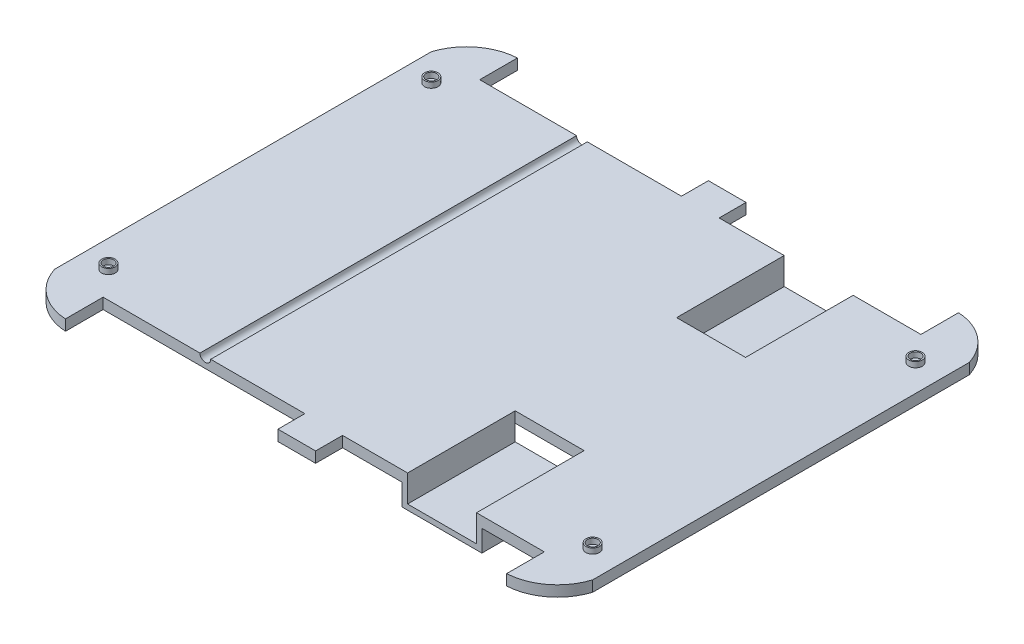
from build123d import *

# Parameters (mm, degrees)
BOSS_EXTRUDE2_DEPTH     = 2
CUT_EXTRUDE4_DEPTH      = 66.329931884
CUT_EXTRUDE4_DEPTH_BACK = 66.329931884
SKETCH4_R               = 1
BOSS_EXTRUDE3_START     = -15
BOSS_EXTRUDE3_DEPTH     = 20
BOSS_EXTRUDE4_START     = -85
BOSS_EXTRUDE4_DEPTH     = 20
CUT_EXTRUDE5_DEPTH      = 1
CUT_EXTRUDE5_DEPTH_BACK = 40
CUT_EXTRUDE5_START      = 5
SKETCH6_4_W             = 12.81
SKETCH6_4_H             = 5
CUT_EXTRUDE6_START      = -65
SKETCH6_6_W             = 12.81
SKETCH6_6_H             = 5
CUT_EXTRUDE6_DEPTH      = 20
SKETCH11_R              = 1.25
SKETCH11_R_2            = 1
BOSS_EXTRUDE6_DEPTH     = 1


with BuildPart() as part:
    # Sketch1 → Boss-Extrude2 (new body)
    with BuildSketch(Plane(origin=(0, 0, 0), x_dir=(1, 0, 0), z_dir=(0, 1, 0))):
        with BuildLine():
            Line((-3.5, 40), (-3.5, 35))
            Line((-3.5, 35), (-41, 35))
            Line((-41, 35), (-41, 42))
            ThreePointArc((-41, 42), (-46.59536929, 39.908331945), (-50, 35))
            Line((-50, 35), (-50, -35))
            ThreePointArc((-50, -35), (-46.59536929, -39.908331945), (-41, -42))
            Line((-41, -42), (-41, -35))
            Line((-41, -35), (-3.5, -35))
            Line((-3.5, -35), (-3.5, -40))
            Line((-3.5, -40), (3.5, -40))
            Line((3.5, -40), (3.5, -35))
            Line((3.5, -35), (41, -35))
            Line((41, -35), (41, -42))
            ThreePointArc((41, -42), (46.59536929, -39.908331945), (50, -35))
            Line((50, -35), (50, 35))
            ThreePointArc((50, 35), (46.59536929, 39.908331945), (41, 42))
            Line((41, 42), (41, 35))
            Line((41, 35), (3.5, 35))
            Line((3.5, 35), (3.5, 40))
            Line((3.5, 40), (-3.5, 40))
        make_face()
    extrude(amount=BOSS_EXTRUDE2_DEPTH)

    # Sketch4 → Cut-Extrude4 (cut, two sides: drawn at the far end of the back side and taken through both)
    with BuildSketch(Plane.XY.offset(-CUT_EXTRUDE4_DEPTH_BACK)):
        with Locations((-22, 2)):
            Circle(SKETCH4_R)
    extrude(amount=CUT_EXTRUDE4_DEPTH + CUT_EXTRUDE4_DEPTH_BACK, mode=Mode.SUBTRACT)

    # Sketch6 → Boss-Extrude3 (add)
    with BuildSketch(Plane.XY.offset(50).offset(BOSS_EXTRUDE3_START)):
        Polygon((15.595, -3), (15.595, 0), (14.595, 0), (14.595, -4), (29.405, -4), (29.405, 0), (28.405, 0), (28.405, -3), align=None)
    extrude(amount=-BOSS_EXTRUDE3_DEPTH)

    # Sketch6<3> → Boss-Extrude4 (add)
    with BuildSketch(Plane.XY.offset(50).offset(BOSS_EXTRUDE4_START)):
        Polygon((15.595, -3), (15.595, 0), (14.595, 0), (14.595, -4), (29.405, -4), (29.405, 0), (28.405, 0), (28.405, -3), align=None)
    extrude(amount=BOSS_EXTRUDE4_DEPTH)

    # Sketch6<4> → Cut-Extrude5 (cut, two sides: drawn at the far end of the back side and taken through both)
    with BuildSketch(Plane.XY.offset(50).offset(CUT_EXTRUDE5_START - CUT_EXTRUDE5_DEPTH_BACK)):
        with Locations((22, -0.5)):
            Rectangle(SKETCH6_4_W, SKETCH6_4_H)
    extrude(amount=CUT_EXTRUDE5_DEPTH + CUT_EXTRUDE5_DEPTH_BACK, mode=Mode.SUBTRACT)

    # Sketch6<6> → Cut-Extrude6 (cut)
    with BuildSketch(Plane.XY.offset(50).offset(CUT_EXTRUDE6_START)):
        with Locations((22, -0.5)):
            Rectangle(SKETCH6_6_W, SKETCH6_6_H)
    extrude(amount=-CUT_EXTRUDE6_DEPTH, mode=Mode.SUBTRACT)

    # Sketch11 → Boss-Extrude6 (add)
    # profile 1 of 4: a face of its own
    with BuildSketch(Plane(origin=(0, 2, 0), x_dir=(1, 0, 0), z_dir=(0, 1, 0))):
        with Locations((-45, 30)):
            Circle(SKETCH11_R)
        with Locations((-45, 30)):
            Circle(SKETCH11_R_2, mode=Mode.SUBTRACT)
    # profile 2 of 4: a face of its own
    with BuildSketch(Plane(origin=(0, 2, 0), x_dir=(1, 0, 0), z_dir=(0, 1, 0))):
        with Locations((45, 30)):
            Circle(SKETCH11_R)
        with Locations((45, 30)):
            Circle(SKETCH11_R_2, mode=Mode.SUBTRACT)
    # profile 3 of 4: a face of its own
    with BuildSketch(Plane(origin=(0, 2, 0), x_dir=(1, 0, 0), z_dir=(0, 1, 0))):
        with Locations((-45, -30)):
            Circle(SKETCH11_R)
        with Locations((-45, -30)):
            Circle(SKETCH11_R_2, mode=Mode.SUBTRACT)
    # profile 4 of 4: a face of its own
    with BuildSketch(Plane(origin=(0, 2, 0), x_dir=(1, 0, 0), z_dir=(0, 1, 0))):
        with Locations((45, -30)):
            Circle(SKETCH11_R)
        with Locations((45, -30)):
            Circle(SKETCH11_R_2, mode=Mode.SUBTRACT)
    extrude(amount=BOSS_EXTRUDE6_DEPTH)


solid = part.part
